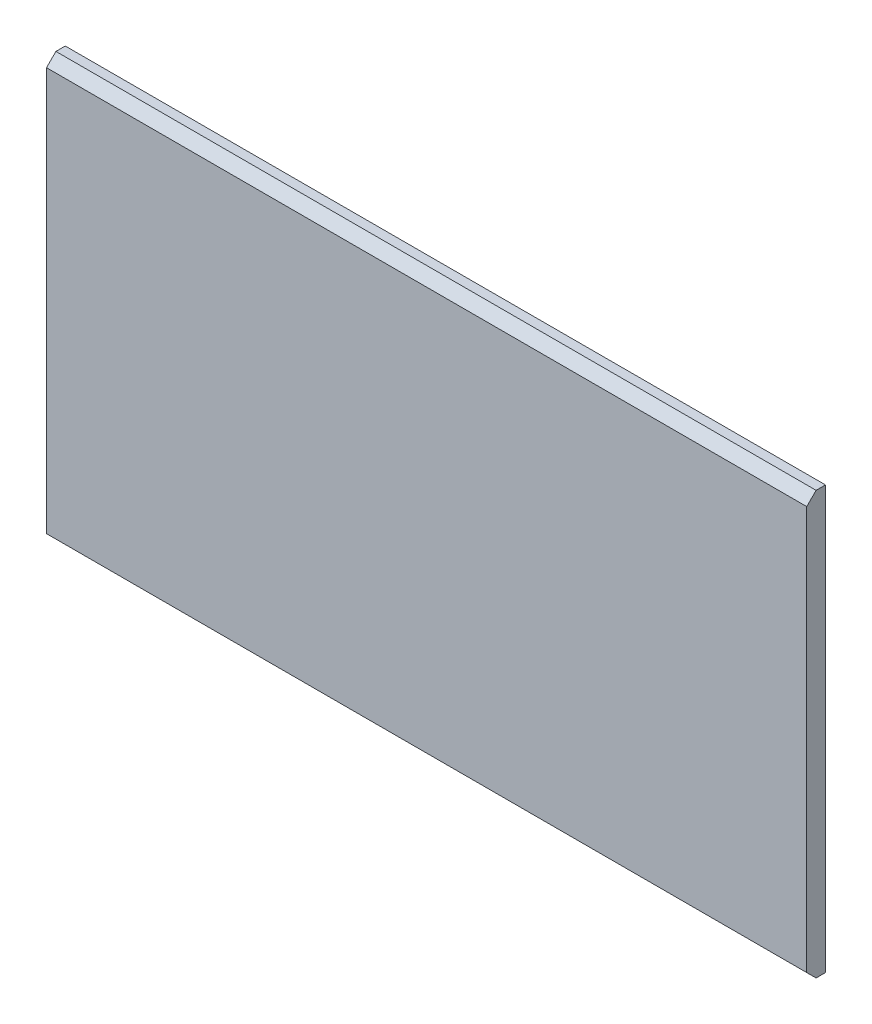
from build123d import *

# Parameters (mm, degrees)
SKETCH_1_W      = 405
SKETCH_1_H      = 225
EXTRUDE_1_DEPTH = 10
CHAMFER_1_SIZE  = 5


with BuildPart() as part:
    # 草图1 → 凸台-拉伸1 (new body)
    with BuildSketch(Plane.XY):
        Rectangle(SKETCH_1_W, SKETCH_1_H)
    extrude(amount=EXTRUDE_1_DEPTH)

    # 倒角1
    chamfer_1_edges = [part.edges().sort_by_distance(p)[0] for p in [
        (0, -112.5, 10),
        (0, 112.5, 10),
    ]]
    chamfer(chamfer_1_edges, length=CHAMFER_1_SIZE)


solid = part.part
